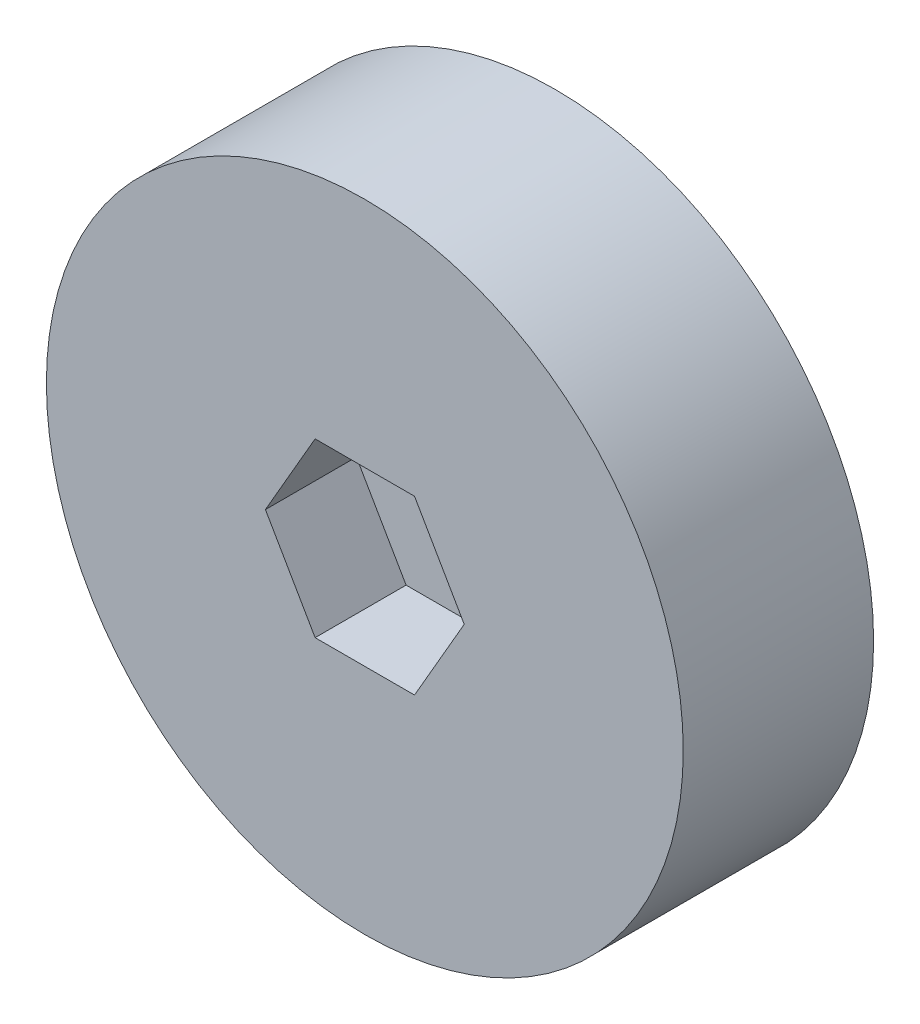
from build123d import *

# Parameters (mm, degrees)
SKETCH16_R           = 22.75
BOSS_EXTRUDE9_DEPTH  = 6.5
BOSS_EXTRUDE10_START = 7.1
SKETCH18_R           = 22.75
SKETCH18_R_2         = 2.25
BOSS_EXTRUDE10_DEPTH = 7.1
BOSS_EXTRUDE11_START = 7
SKETCH19_R           = 4
SKETCH19_R_2         = 2.25
BOSS_EXTRUDE11_DEPTH = 7


with BuildPart() as part:
    # Sketch16 → Boss-Extrude9 (new body)
    with BuildSketch(Plane.XY):
        with Locations(Location((0, 0, 0), (0, 0, 180))):
            Circle(SKETCH16_R)
        Polygon((7.101408311, 0), (3.550704156, 6.15), (-3.550704156, 6.15), (-7.101408311, 0), (-3.550704156, -6.15), (3.550704156, -6.15), align=None, mode=Mode.SUBTRACT)
    extrude(amount=BOSS_EXTRUDE9_DEPTH)

    # Sketch18 → Boss-Extrude10 (add)
    with BuildSketch(Plane(origin=(0, 0, 0), x_dir=(-1, 0, 0), z_dir=(0, 0, -1)).offset(BOSS_EXTRUDE10_START)):
        Circle(SKETCH18_R)
        Circle(SKETCH18_R_2, mode=Mode.SUBTRACT)
    extrude(amount=-BOSS_EXTRUDE10_DEPTH)

    # Sketch19 → Boss-Extrude11 (add)
    with BuildSketch(Plane(origin=(0, 0, -7.1), x_dir=(-1, 0, 0), z_dir=(0, 0, -1)).offset(BOSS_EXTRUDE11_START)):
        Circle(SKETCH19_R)
        Circle(SKETCH19_R_2, mode=Mode.SUBTRACT)
    extrude(amount=-BOSS_EXTRUDE11_DEPTH)


solid = part.part
